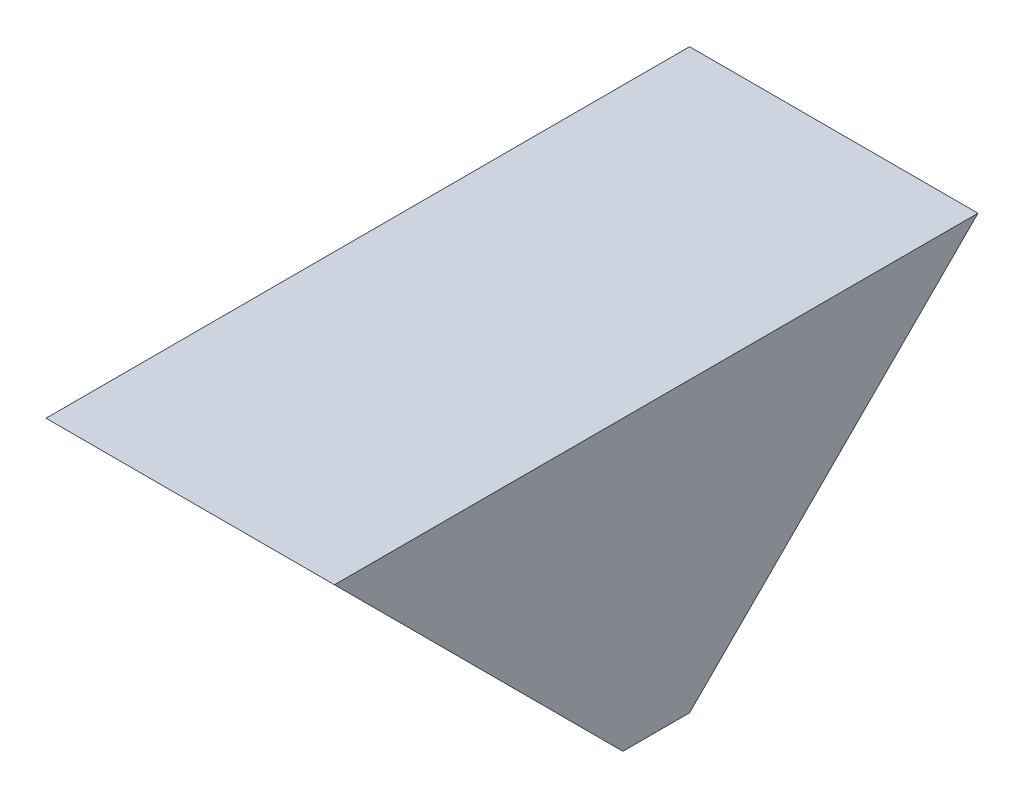
from build123d import *

# Parameters (mm, degrees)
CROQUIS2_W              = 76.2
CROQUIS2_H              = 76.2
CROQUIS2_W_2            = 66.675
CROQUIS2_H_2            = 66.675
SALIENTE_EXTRUIR1_DEPTH = 170
CORTAR_EXTRUIR1_REACH   = 203.278


with BuildPart() as part:
    # Croquis2 → Saliente-Extruir1 (new body)
    with BuildSketch(Plane.XY):
        with Locations((38.1, -38.1)):
            Rectangle(CROQUIS2_W, CROQUIS2_H)
        with Locations((38.1, -38.1)):
            Rectangle(CROQUIS2_W_2, CROQUIS2_H_2, mode=Mode.SUBTRACT)
    extrude(amount=-SALIENTE_EXTRUIR1_DEPTH)

    # Cortar-Extruir1: up to this face of the body (flat: up to its plane)
    cortar_extruir1_end = Plane(part.part.faces().sort_by_distance((0, -38.1, -85))[0])
    # Croquis3 → Cortar-Extruir1 (cut, up to the picked face)
    with BuildSketch(Plane(origin=(76.2, 0, 0), x_dir=(0, 0, -1), z_dir=(1, 0, 0)), mode=Mode.PRIVATE) as cortar_extruir1_sk1:
        Polygon((0, 0), (76.2, -76.2), (0, -76.2), align=None)
    cortar_extruir1_tool1 = split(extrude(cortar_extruir1_sk1.sketch, amount=-CORTAR_EXTRUIR1_REACH, mode=Mode.PRIVATE), bisect_by=cortar_extruir1_end, keep=Keep.BOTH, mode=Mode.PRIVATE)
    # Croquis3 → Cortar-Extruir1 (cut, up to the picked face)
    with BuildSketch(Plane(origin=(76.2, 0, 0), x_dir=(0, 0, -1), z_dir=(1, 0, 0)), mode=Mode.PRIVATE) as cortar_extruir1_sk2:
        Polygon((170, 0), (93.8, -76.2), (170, -76.2), align=None)
    cortar_extruir1_tool2 = split(extrude(cortar_extruir1_sk2.sketch, amount=-CORTAR_EXTRUIR1_REACH, mode=Mode.PRIVATE), bisect_by=cortar_extruir1_end, keep=Keep.BOTH, mode=Mode.PRIVATE)
    add(cortar_extruir1_tool1.solids().sort_by(Axis((76.2, -50.8, -25.4), (-1, 0, 0)))[0], mode=Mode.SUBTRACT)
    add(cortar_extruir1_tool2.solids().sort_by(Axis((76.2, -50.8, -144.6), (-1, 0, 0)))[0], mode=Mode.SUBTRACT)


solid = part.part
